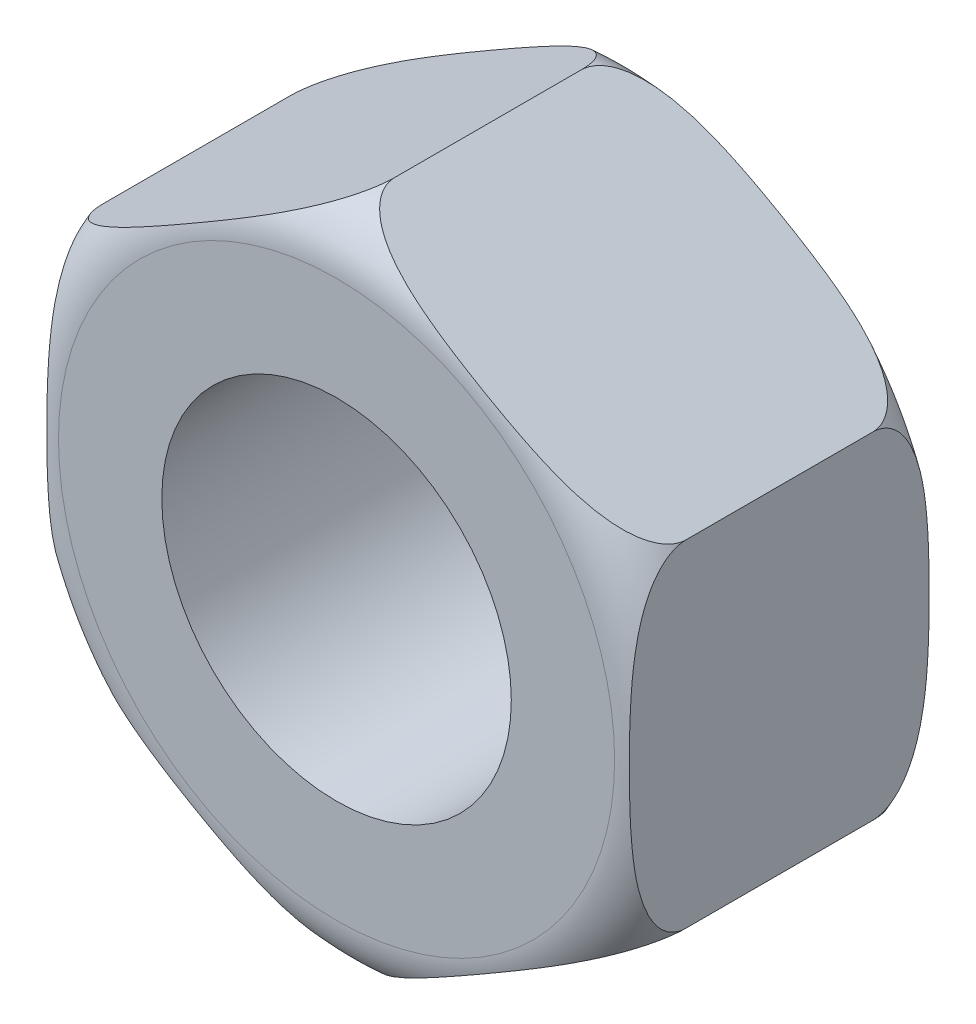
from build123d import *

# Parameters (mm, degrees)
HEAD_DEPTH         = 5.2
HOLE_SKETCH_R      = 3
THROUGH_HOLE_DEPTH = 10.23976929


with BuildPart() as part:
    # Head Sketch → Head (new body)
    with BuildSketch(Plane.XY):
        Polygon((0, 5.773502692), (5, 2.886751346), (5, -2.886751346), (0, -5.773502692), (-5, -2.886751346), (-5, 2.886751346), align=None)
    extrude(amount=HEAD_DEPTH)

    # Sketch5 → Head Trim (revolve, cut)
    with BuildSketch(Plane(origin=(0, 0, 0), x_dir=(0, 0, -1), z_dir=(1, 0, 0)), mode=Mode.PRIVATE) as head_trim_sk:
        with BuildLine():
            Line((-5.2, -4.773502692), (-5.2, -5.773502692))
            Line((-5.2, -5.773502692), (-4.2, -5.773502692))
            ThreePointArc((-4.2, -5.773502692), (-4.907106781, -5.480609473), (-5.2, -4.773502692))
        make_face()
    head_trim = revolve(head_trim_sk.sketch.rotate(Axis((0, 0, 15.085599173), (0, 0, -1)), 270), axis=Axis((0, 0, 15.085599173), (0, 0, -1)), mode=Mode.SUBTRACT)

    # Hole Sketch → Through Hole (cut, through all)
    with BuildSketch(Plane.XY.offset(5.2)):
        Circle(HOLE_SKETCH_R)
    extrude(amount=-THROUGH_HOLE_DEPTH, mode=Mode.SUBTRACT)

    # Symétrie2: Head Trim across plane
    add(head_trim.mirror(Plane.XY.offset(2.6)), mode=Mode.SUBTRACT)


solid = part.part
